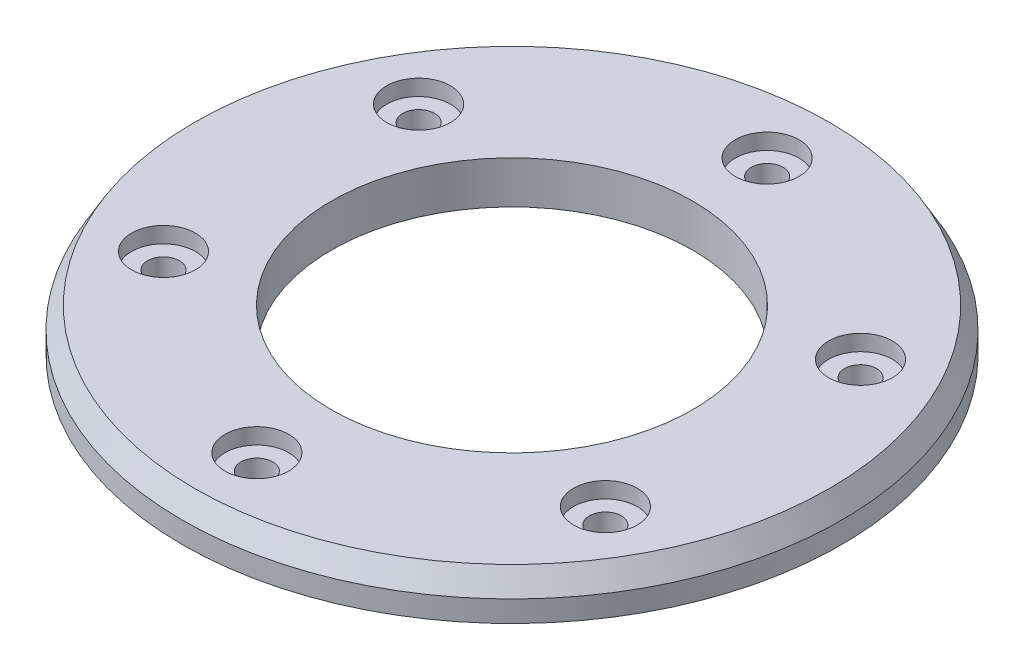
from build123d import *

# Parameters (mm, degrees)
SKETCH1_R           = 31
SKETCH1_R_2         = 17
SKETCH1_R_3         = 1.5
BOSS_EXTRUDE1_DEPTH = 4
SKETCH2_R           = 3
CUT_EXTRUDE1_DEPTH  = 1.5
CHAMFER1_SIZE       = 2
CHAMFER1_SIZE2      = 1.154700538


with BuildPart() as part:
    # Sketch1 → Boss-Extrude1 (new body)
    with BuildSketch(Plane(origin=(0, 0, 0), x_dir=(1, 0, 0), z_dir=(0, 1, 0))):
        with Locations(Location((0, 0, 0), (0, 0, 270))):
            Circle(SKETCH1_R)
        with Locations(Location((0, 0, 0), (0, 0, 270))):
            Circle(SKETCH1_R_2, mode=Mode.SUBTRACT)
        with Locations(Location((0, 24, 0), (0, 0, 270))):
            Circle(SKETCH1_R_3, mode=Mode.SUBTRACT)
        with Locations(Location((20.784609691, 12, 0), (0, 0, 270))):
            Circle(SKETCH1_R_3, mode=Mode.SUBTRACT)
        with Locations(Location((20.784609691, -12, 0), (0, 0, 270))):
            Circle(SKETCH1_R_3, mode=Mode.SUBTRACT)
        with Locations(Location((0, -24, 0), (0, 0, 270))):
            Circle(SKETCH1_R_3, mode=Mode.SUBTRACT)
        with Locations(Location((-20.784609691, -12, 0), (0, 0, 270))):
            Circle(SKETCH1_R_3, mode=Mode.SUBTRACT)
        with Locations(Location((-20.784609691, 12, 0), (0, 0, 270))):
            Circle(SKETCH1_R_3, mode=Mode.SUBTRACT)
    extrude(amount=BOSS_EXTRUDE1_DEPTH)

    # Sketch2 → Cut-Extrude1 (cut)
    with BuildSketch(Plane(origin=(0, 4, 0), x_dir=(1, 0, 0), z_dir=(0, 1, 0))):
        with Locations(Location((0, 24, 0), (0, 0, 270))):
            Circle(SKETCH2_R)
        with Locations(Location((20.784609691, 12, 0), (0, 0, 270))):
            Circle(SKETCH2_R)
        with Locations(Location((20.784609691, -12, 0), (0, 0, 270))):
            Circle(SKETCH2_R)
        with Locations(Location((0, -24, 0), (0, 0, 270))):
            Circle(SKETCH2_R)
        with Locations(Location((-20.784609691, -12, 0), (0, 0, 270))):
            Circle(SKETCH2_R)
        with Locations(Location((-20.784609691, 12, 0), (0, 0, 270))):
            Circle(SKETCH2_R)
    extrude(amount=-CUT_EXTRUDE1_DEPTH, mode=Mode.SUBTRACT)

    # Chamfer1
    chamfer1_edges = [part.edges().sort_by_distance(p)[0] for p in [
        (0, 4, -31),
    ]]
    chamfer1_side = [part.faces().sort_by_distance(p)[0] for p in [
        (0, 2, -31),
    ]]
    chamfer(chamfer1_edges, length=CHAMFER1_SIZE, length2=CHAMFER1_SIZE2, reference=chamfer1_side[0])


solid = part.part
